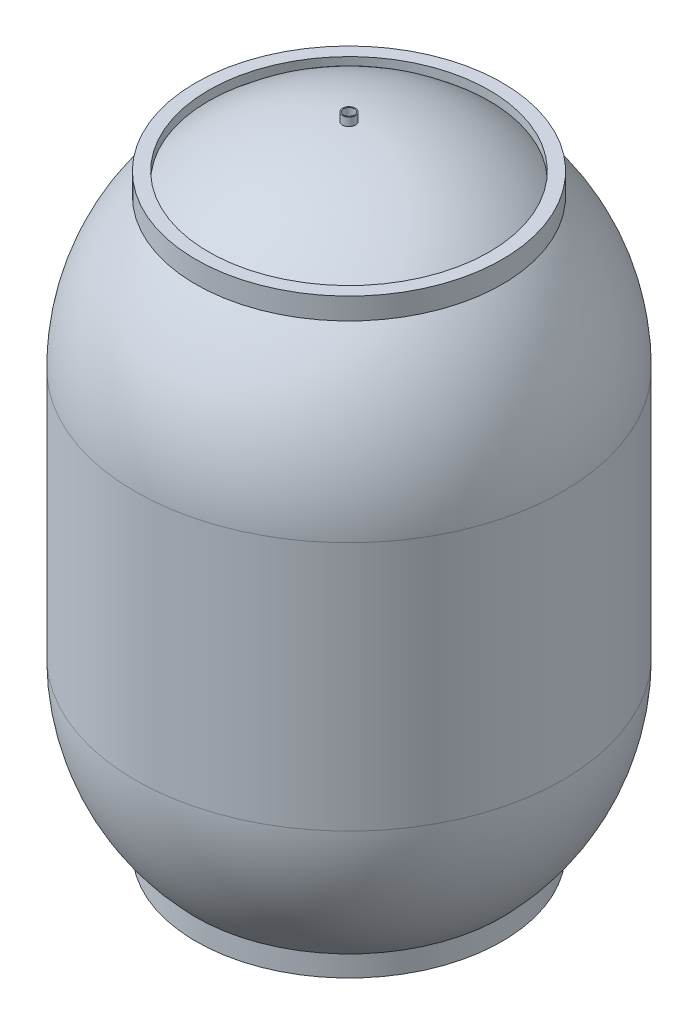
from build123d import *

# Parameters (mm, degrees)
CUT_EXTRUDE1_DEPTH      = 3441.466020149
CUT_EXTRUDE1_DEPTH_BACK = 3441.466020149
SKETCH2_R               = 30
BOSS_EXTRUDE2_START     = 40
SKETCH3_R               = 30
SKETCH3_R_2             = 25
BOSS_EXTRUDE2_DEPTH     = 40
LPATTERN1_COUNT         = 2
LPATTERN1_PITCH         = 3179.07


with BuildPart() as part:
    # Sketch1 → Revolve1 (revolve)
    with BuildSketch(Plane.XY, mode=Mode.PRIVATE) as revolve1_sk:
        with BuildLine():
            Line((0, -3139.07), (0, -3141.3))
            ThreePointArc((0, -3141.3), (346.846238096, -3078.703293304), (649.929573972, -2898.811236545))
            Line((649.929573972, -2898.811236545), (649.929573972, -2939.07))
            Line((649.929573972, -2939.07), (709.929573972, -2939.07))
            Line((709.929573972, -2939.07), (709.929573972, -2842.265768092))
            ThreePointArc((709.929573972, -2842.265768092), (918.948800011, -2523.307191977), (992.23, -2149.07))
            Line((992.23, -2149.07), (992.23, -990))
            ThreePointArc((992.23, -990), (919.202969777, -616.387536005), (710.871296368, -297.77))
            Line((710.871296368, -297.77), (710.871296368, -197.77))
            Line((710.871296368, -197.77), (650.871296368, -197.77))
            Line((650.871296368, -197.77), (650.871296368, -241.076153094))
            ThreePointArc((650.871296368, -241.076153094), (347.430327033, -60.584839398), (0, 2.23))
            Line((0, 2.23), (0, 0))
            ThreePointArc((0, 0), (700.035713375, -289.964286625), (990, -990))
            Line((990, -990), (990, -2149.07))
            ThreePointArc((990, -2149.07), (700.035713375, -2849.105713375), (0, -3139.07))
        make_face()
    revolve(revolve1_sk.sketch.rotate(Axis((0, 0, 0), (0, -1, 0)), 180), axis=Axis((0, 0, 0), (0, -1, 0)))

    # Sketch2 → Cut-Extrude1 (cut, two sides: drawn at the far end of the back side and taken through both)
    with BuildSketch(Plane(origin=(0, 0, 0), x_dir=(1, 0, 0), z_dir=(0, 1, 0)).offset(-CUT_EXTRUDE1_DEPTH_BACK)):
        with Locations(Location((0, 0, 0), (0, 0, 180))):
            Circle(SKETCH2_R)
    extrude(amount=CUT_EXTRUDE1_DEPTH + CUT_EXTRUDE1_DEPTH_BACK, mode=Mode.SUBTRACT)

    # Sketch3 → Boss-Extrude2 (add)
    with BuildSketch(Plane(origin=(0, 0, 0), x_dir=(1, 0, 0), z_dir=(0, 1, 0)).offset(BOSS_EXTRUDE2_START)):
        with Locations(Location((0, 0, 0), (0, 0, 270))):
            Circle(SKETCH3_R)
        with Locations(Location((0, 0, 0), (0, 0, 270))):
            Circle(SKETCH3_R_2, mode=Mode.SUBTRACT)
    boss_extrude2 = extrude(amount=-BOSS_EXTRUDE2_DEPTH)

    # LPattern1: Boss-Extrude2 ×2
    with Locations(*[(0, -i * LPATTERN1_PITCH, 0) for i in range(1, LPATTERN1_COUNT)]):
        add(boss_extrude2)


solid = part.part
